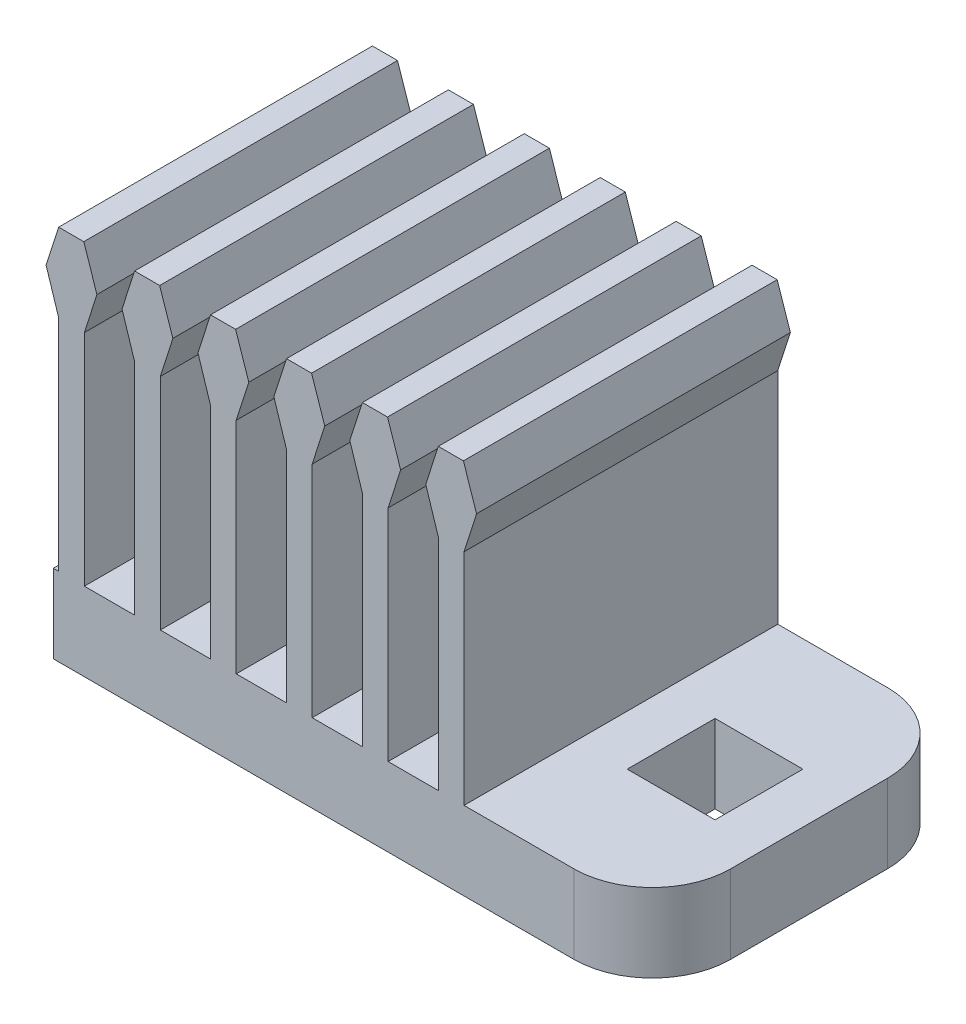
from build123d import *

# Parameters (mm, degrees)
RESSALTO_EXTRUS_O1_DEPTH = 10
ESBO_O2_W                = 2.8
ESBO_O2_H                = 2.8
CORTE_EXTRUS_O1_DEPTH    = 24.091998614


with BuildPart() as part:
    # Esboço1 → Ressalto-extrusão1 (new body)
    with BuildSketch(Plane.XY):
        Polygon((-0.4, 7), (-0.4, 0), (-0.57, 0), (-0.57, -2.5), (5.43, -2.5), (18.52, -2.5), (18.52, 0), (12.52, 0), (12.52, 7), (12.92, 8.25), (12.5, 9.5), (11.7, 9.5), (11.3, 8.25), (11.7, 7), (11.7, 0), (10.1, 0), (10.1, 7), (10.5, 8.25), (10.08, 9.5), (9.28, 9.5), (8.88, 8.25), (9.28, 7), (9.28, 0), (7.68, 0), (7.68, 7), (8.08, 8.25), (7.66, 9.5), (6.86, 9.5), (6.46, 8.25), (6.86, 7), (6.86, 0), (5.26, 0), (5.26, 7), (5.66, 8.25), (5.24, 9.5), (4.44, 9.5), (4.04, 8.25), (4.44, 7), (4.44, 0), (2.84, 0), (2.84, 7), (3.24, 8.25), (2.82, 9.5), (2.02, 9.5), (1.62, 8.25), (2.02, 7), (2.02, 0), (0.42, 0), (0.42, 7), (0.82, 8.25), (0.4, 9.5), (-0.4, 9.5), (-0.8, 8.25), align=None)
    extrude(amount=RESSALTO_EXTRUS_O1_DEPTH)

    # Esboço2 → Corte-extrusão1 (cut, through all)
    with BuildSketch(Plane(origin=(0, 0, 0), x_dir=(1, 0, 0), z_dir=(0, 1, 0))):
        with Locations((15.52, -5)):
            Rectangle(ESBO_O2_W, ESBO_O2_H)
        with BuildLine():
            ThreePointArc((16.02, 0), (17.787766953, -0.732233047), (18.52, -2.5))
            Line((18.52, -2.5), (18.52, 0))
            Line((18.52, 0), (16.02, 0))
        make_face()
        with BuildLine():
            Line((18.52, -10), (18.52, -7.5))
            ThreePointArc((18.52, -7.5), (17.787766953, -9.267766953), (16.02, -10))
            Line((16.02, -10), (18.52, -10))
        make_face()
    extrude(amount=-CORTE_EXTRUS_O1_DEPTH, mode=Mode.SUBTRACT)


solid = part.part
